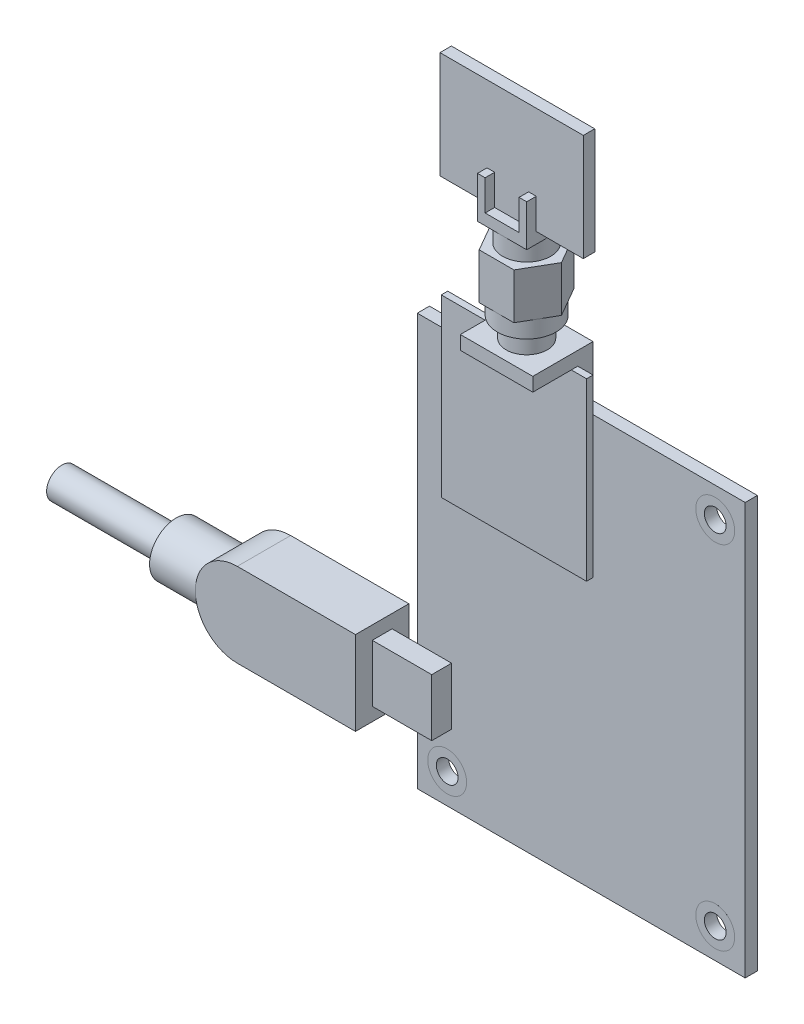
from build123d import *

# Parameters (mm, degrees)
SKETCH1_W                     = 19.05
SKETCH1_H                     = 23
BLUE_PCB_DEPTH                = 0.425
SKETCH20_W                    = 43
SKETCH20_H                    = 54
GREEN_PCB_DEPTH               = 1.6
SKETCH21_R                    = 1.425
MOUNTING_HOLES_DEPTH          = 53.76182332
SCREW_MASK_DEPTH              = 0.801
SCREW_MASK_DEPTH_BACK         = 0.801
SKETCH22_R                    = 2.55
SKETCH22_R_2                  = 1.425
SKETCH4_W                     = 9.5
SKETCH4_H                     = 7.9
ANTENNA1_DEPTH                = 1.8
SKETCH10_W                    = 1.25
SKETCH10_H                    = 4.5
ANTENNA2_DEPTH                = 2
SKETCH5_R                     = 2.7
ANTENNA3_DEPTH                = 2.6
SKETCH6_R                     = 3.85
ANTENNA4_DEPTH                = 2.25
ANTENNA5_DEPTH                = 6
SKETCH8_R                     = 3.15
ANTENNA6_DEPTH                = 2.4
SKETCH9_W                     = 6.45
SKETCH9_H                     = 6.45
ANTENNA7_DEPTH                = 1.45
SKETCH19_W                    = 1
SKETCH19_H                    = 4
ANTENNA8_DEPTH                = 1.25
SKETCH11_W                    = 18.8
SKETCH11_H                    = 1.5
ANTENNA_PCB_DEPTH             = 14
SKETCH14_W                    = 7.8
SKETCH14_H                    = 7.5
USB_PORT_DEPTH                = 2.6
USB_BODY_DEPTH                = 3.5
USB_TENSION_RELIEF_DEPTH      = 6
USB_TENSION_RELIEF_DEPTH_BACK = 6
SKETCH17_R                    = 3.5
SKETCH18_R                    = 2
USB_CORD_DEPTH                = 15


with BuildPart() as part:
    # Sketch1 → Blue PCB (new, symmetric)
    with BuildSketch(Plane.XY):
        with Locations((9.525, 11.5)):
            Rectangle(SKETCH1_W, SKETCH1_H)
    extrude(amount=BLUE_PCB_DEPTH, both=True)

    # Sketch20 → Green PCB (add)
    with BuildSketch(Plane(origin=(0, 0, -0.425), x_dir=(-1, 0, 0), z_dir=(0, 0, -1))):
        with Locations((-17.5, -8.5)):
            Rectangle(SKETCH20_W, SKETCH20_H)
    extrude(amount=GREEN_PCB_DEPTH)

    # Sketch21 → Mounting Holes (cut, through all)
    with BuildSketch(Plane.XY.offset(-0.425)):
        with Locations((35.075, 14.575)):
            Circle(SKETCH21_R)
        with Locations((35.075, -31.575)):
            Circle(SKETCH21_R)
        with Locations((-0.075, -31.575)):
            Circle(SKETCH21_R)
    extrude(amount=-MOUNTING_HOLES_DEPTH, mode=Mode.SUBTRACT)

    # Sketch22 → Screw Mask (add, two sides: drawn at the far end of the back side and taken through both)
    # profile 1 of 3: a face of its own
    with BuildSketch(Plane.XY.offset(-1.225).offset(-SCREW_MASK_DEPTH_BACK)):
        with Locations((35.075, 14.575)):
            Circle(SKETCH22_R)
        with Locations((35.075, 14.575)):
            Circle(SKETCH22_R_2, mode=Mode.SUBTRACT)
    # profile 2 of 3: a face of its own
    with BuildSketch(Plane.XY.offset(-1.225).offset(-SCREW_MASK_DEPTH_BACK)):
        with Locations((35.075, -31.575)):
            Circle(SKETCH22_R)
        with Locations((35.075, -31.575)):
            Circle(SKETCH22_R_2, mode=Mode.SUBTRACT)
    # profile 3 of 3: a face of its own
    with BuildSketch(Plane.XY.offset(-1.225).offset(-SCREW_MASK_DEPTH_BACK)):
        with Locations((-0.075, -31.575)):
            Circle(SKETCH22_R)
        with Locations((-0.075, -31.575)):
            Circle(SKETCH22_R_2, mode=Mode.SUBTRACT)
    extrude(amount=SCREW_MASK_DEPTH + SCREW_MASK_DEPTH_BACK)

    # Sketch4 → Antenna1 (add)
    with BuildSketch(Plane(origin=(0, 23, 0), x_dir=(1, 0, 0), z_dir=(0, 1, 0))):
        with Locations((12.3, -1.525)):
            Rectangle(SKETCH4_W, SKETCH4_H)
    extrude(amount=ANTENNA1_DEPTH)

    # Sketch10 → Antenna2 (add)
    with BuildSketch(Plane.XY.offset(-2.425)):
        with Locations((8.175, 20.75)):
            Rectangle(SKETCH10_W, SKETCH10_H)
        with Locations((16.425, 20.75)):
            Rectangle(SKETCH10_W, SKETCH10_H)
    extrude(amount=ANTENNA2_DEPTH)

    # Sketch5 → Antenna3 (add)
    with BuildSketch(Plane(origin=(0, 24.8, 0), x_dir=(1, 0, 0), z_dir=(0, 1, 0))):
        with Locations(Location((12.3, -1.525, 0), (0, 0, 270))):
            Circle(SKETCH5_R)
    extrude(amount=ANTENNA3_DEPTH)

    # Sketch6 → Antenna4 (add)
    with BuildSketch(Plane(origin=(0, 27.4, 0), x_dir=(1, 0, 0), z_dir=(0, 1, 0))):
        with Locations(Location((12.3, -1.525, 0), (0, 0, 270))):
            Circle(SKETCH6_R)
    extrude(amount=ANTENNA4_DEPTH)

    # Sketch7 → Antenna5 (add)
    with BuildSketch(Plane(origin=(0, 29.65, 0), x_dir=(1, 0, 0), z_dir=(0, 1, 0))):
        Polygon((10.019466437, -5.475), (14.580533563, -5.475), (16.861067127, -1.525), (14.580533563, 2.425), (10.019466437, 2.425), (7.738932873, -1.525), align=None)
    extrude(amount=ANTENNA5_DEPTH)

    # Sketch8 → Antenna6 (add)
    with BuildSketch(Plane(origin=(0, 35.65, 0), x_dir=(1, 0, 0), z_dir=(0, 1, 0))):
        with Locations(Location((12.3, -1.525, 0), (0, 0, 270))):
            Circle(SKETCH8_R)
    extrude(amount=ANTENNA6_DEPTH)

    # Sketch9 → Antenna7 (add)
    with BuildSketch(Plane(origin=(0, 38.05, 0), x_dir=(1, 0, 0), z_dir=(0, 1, 0))):
        with Locations((12.3, -1.525)):
            Rectangle(SKETCH9_W, SKETCH9_H)
    extrude(amount=ANTENNA7_DEPTH)

    # Sketch19 → Antenna8 (add)
    with BuildSketch(Plane.XY.offset(4.75)):
        with Locations((9.575, 41.5)):
            Rectangle(SKETCH19_W, SKETCH19_H)
        with Locations((15.025, 41.5)):
            Rectangle(SKETCH19_W, SKETCH19_H)
    antenna8 = extrude(amount=-ANTENNA8_DEPTH)

    # Sketch11 → Antenna PCB (add)
    with BuildSketch(Plane(origin=(0, 39.5, 0), x_dir=(1, 0, 0), z_dir=(0, 1, 0))):
        with Locations((12.3, -2.75)):
            Rectangle(SKETCH11_W, SKETCH11_H)
    extrude(amount=ANTENNA_PCB_DEPTH)

    # Sketch14 → USB Port (add)
    with BuildSketch(Plane(origin=(0, 0, -0.425), x_dir=(-1, 0, 0), z_dir=(0, 0, -1))):
        with Locations((3.4, -22.75)):
            Rectangle(SKETCH14_W, SKETCH14_H)
    extrude(amount=-USB_PORT_DEPTH)

    # Sketch16 → USB Body (add, symmetric)
    with BuildSketch(Plane.XY.offset(0.875)):
        with BuildLine():
            Line((-22.8, -28.25), (-7.3, -28.25))
            Line((-7.3, -28.25), (-7.3, -17.25))
            Line((-7.3, -17.25), (-22.8, -17.25))
            ThreePointArc((-22.8, -17.25), (-28.3, -22.75), (-22.8, -28.25))
        make_face()
    extrude(amount=USB_BODY_DEPTH, both=True)

    # Sketch17 → USB Tension Relief (add, two sides: drawn at the far end of the back side and taken through both)
    with BuildSketch(Plane.ZY.offset(28.3).offset(-USB_TENSION_RELIEF_DEPTH_BACK)):
        with Locations((0.875, -22.75)):
            Circle(SKETCH17_R)
    extrude(amount=USB_TENSION_RELIEF_DEPTH + USB_TENSION_RELIEF_DEPTH_BACK)

    # Sketch18 → USB Cord (add)
    with BuildSketch(Plane.ZY.offset(34.3)):
        with Locations((0.875, -22.75)):
            Circle(SKETCH18_R)
    extrude(amount=USB_CORD_DEPTH)

    # Mirror1: Antenna8 across plane
    add(antenna8.mirror(Plane(origin=(0, 0, 2.75), x_dir=(1, 0, 0), z_dir=(0, 0, -1))))


solid = part.part
